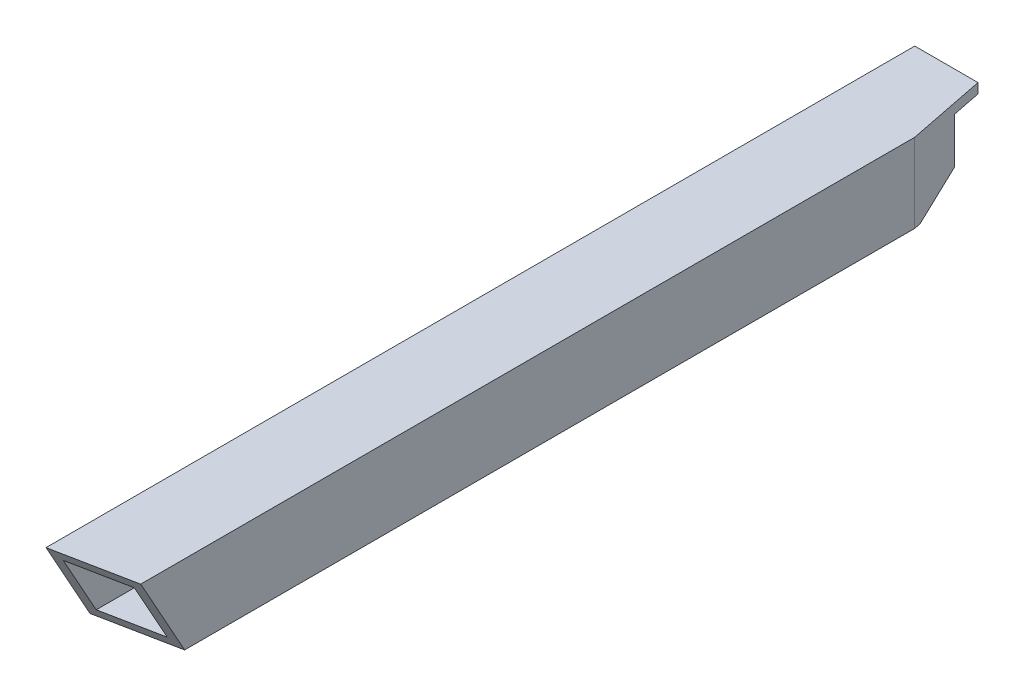
from build123d import *

# Parameters (mm, degrees)
BOSS_EXTRUDE1_DEPTH      = 139.7
BOSS_EXTRUDE1_DEPTH_BACK = 139.7
SKETCH3_W                = 25.4
SKETCH3_H                = 25.4
SKETCH3_W_2              = 19.05
SKETCH3_H_2              = 19.05


with BuildPart() as part:
    # Sketch3 → Boss-Extrude1 (new, two sides: drawn at the far end of the back side and taken through both)
    with BuildSketch(Plane.XY.offset(-BOSS_EXTRUDE1_DEPTH_BACK)):
        Rectangle(SKETCH3_W, SKETCH3_H)
        Rectangle(SKETCH3_W_2, SKETCH3_H_2, mode=Mode.SUBTRACT)
    extrude(amount=BOSS_EXTRUDE1_DEPTH + BOSS_EXTRUDE1_DEPTH_BACK)

    # SurfaceCut2
    split(bisect_by=Plane(origin=(19.203056865, -53.641884581, 96.452303833), x_dir=(0.9807512157806098, 0, -0.1952614983678451), z_dir=(0.17141995510435715, -0.47884508758591265, 0.8610009181684186)), keep=Keep.BOTTOM)

    # SurfaceCut4
    split(bisect_by=Plane(origin=(34.104573835, 0, -6.790009618), x_dir=(0, 1, 0), z_dir=(0.9807512157806096, 0, -0.19526149836784543)), keep=Keep.BOTTOM)

    # SurfaceCut6
    split(bisect_by=Plane(origin=(1.132350751, -58.878507635, -32.094967554), x_dir=(0.9998151166046026, 0.01922843230544169, 0), z_dir=(0.01688375098917382, -0.8778994145657232, -0.478547340247228)), keep=Keep.BOTTOM)


solid = part.part
